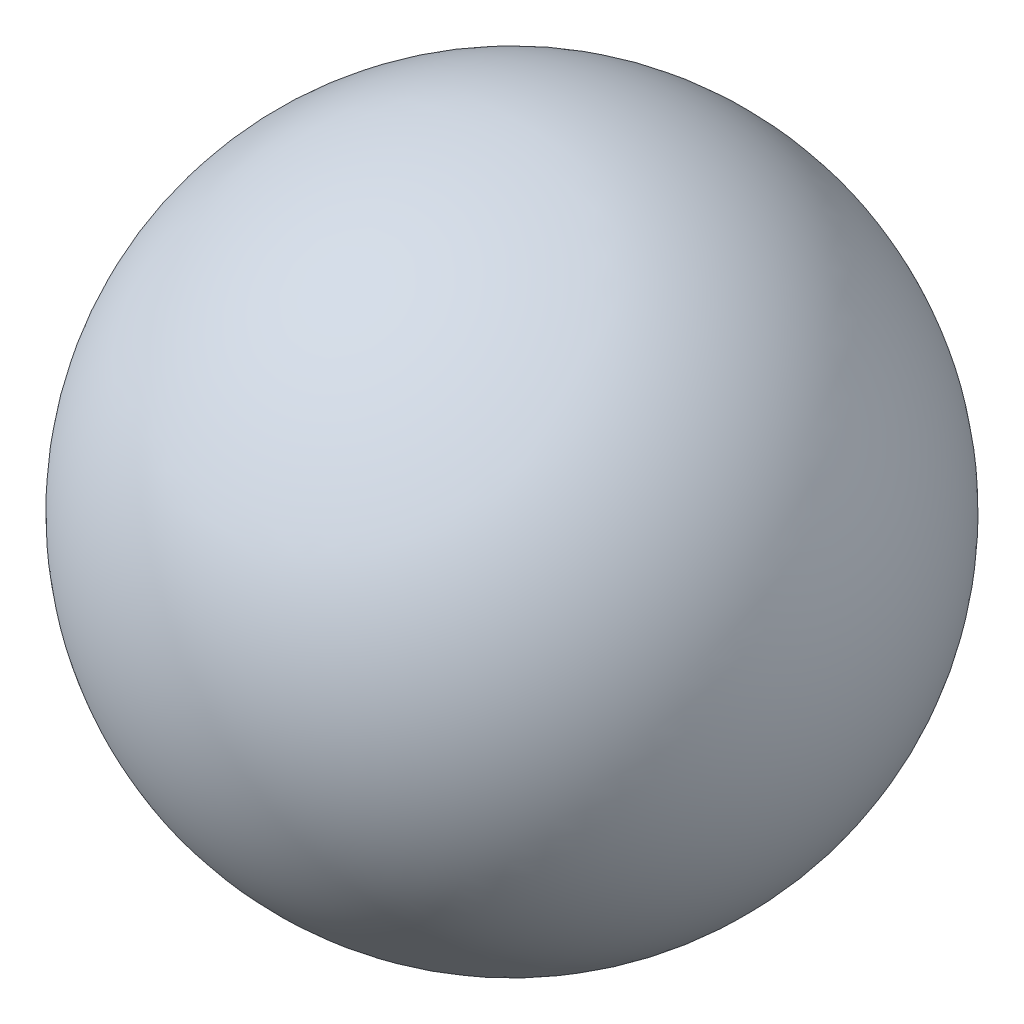
from build123d import *


with BuildPart() as part:
    # Sketch1 → Revolve5 (revolve)
    with BuildSketch(Plane(origin=(0, 0, 0), x_dir=(1, 0, 0), z_dir=(0, 1, 0))):
        with BuildLine():
            Line((0, 21.335), (0, -21.335))
            ThreePointArc((0, -21.335), (-21.335, 0), (0, 21.335))
        make_face()
    revolve(axis=Axis((0, 0, -21.335), (0, 0, 1)))


solid = part.part
